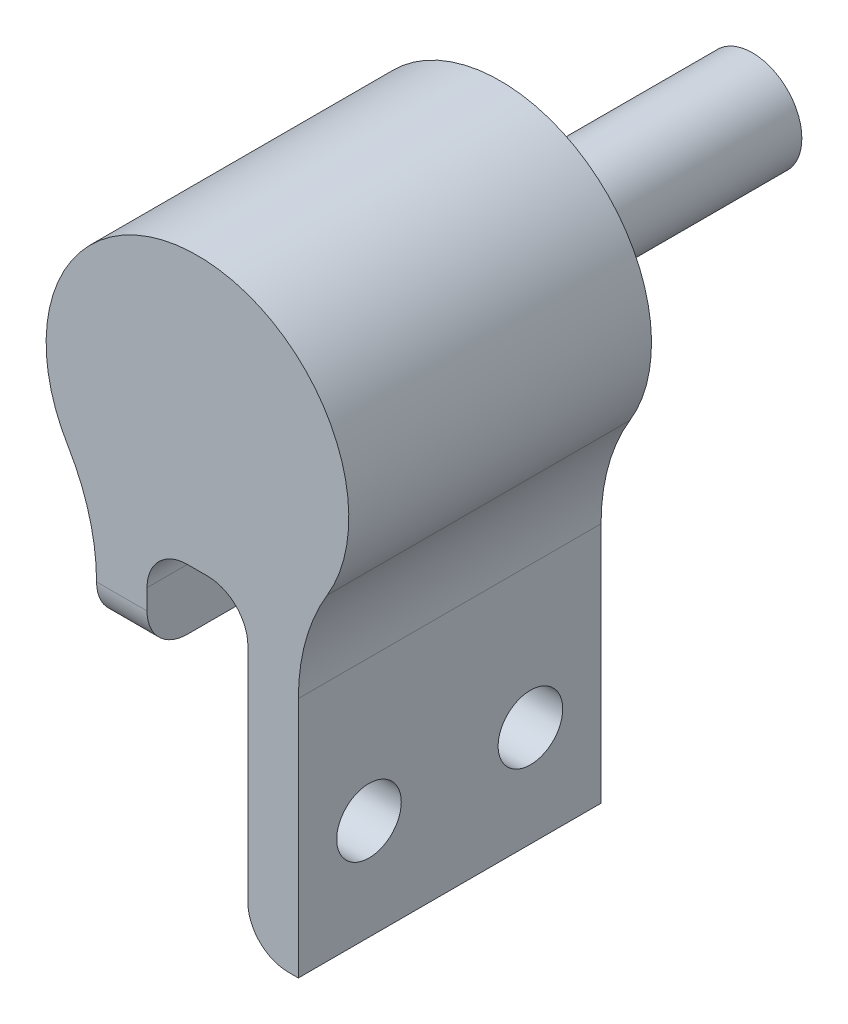
from build123d import *

# Parameters (mm, degrees)
BOSS_EXTRUDE1_DEPTH = 15
SKETCH3_R           = 2.45
BOSS_EXTRUDE2_DEPTH = 12.5
FILLET2_R           = 10
SKETCH8_R           = 1.6
CUT_EXTRUDE6_DEPTH  = 29.681007074
CUT_EXTRUDE7_REACH  = 30.681
SKETCH9_W           = 7.5
SKETCH9_H           = 10
CUT_EXTRUDE8_REACH  = 30.681
SKETCH10_R          = 1.6
FILLET3_R           = 1
FILLET4_R           = 2


with BuildPart() as part:
    # Sketch2 → Boss-Extrude1 (new body)
    with BuildSketch(Plane.XY):
        with BuildLine():
            Line((-2.5, -6.008335649), (-2.5, -21.008335649))
            Line((-2.5, -21.008335649), (-5, -21.008335649))
            Line((-5, -21.008335649), (-5, -6.008335649))
            Line((-5, -6.008335649), (-5, -5.590169944))
            ThreePointArc((-5, -5.590169944), (0, 7.5), (5, -5.590169944))
            Line((5, -5.590169944), (5, -6.008335649))
            Line((5, -6.008335649), (5, -21.008335649))
            Line((5, -21.008335649), (2.5, -21.008335649))
            Line((2.5, -21.008335649), (2.5, -6.008335649))
            Line((2.5, -6.008335649), (-2.5, -6.008335649))
        make_face()
    extrude(amount=BOSS_EXTRUDE1_DEPTH)

    # Sketch3 → Boss-Extrude2 (add)
    with BuildSketch(Plane(origin=(0, 0, 0), x_dir=(-1, 0, 0), z_dir=(0, 0, -1))):
        Circle(SKETCH3_R)
    extrude(amount=BOSS_EXTRUDE2_DEPTH)

    # Fillet2
    fillet2_edges = [part.edges().sort_by_distance(p)[0] for p in [
        (-5, -5.590169944, 7.5),
        (5, -5.590169944, 7.5),
    ]]
    fillet(fillet2_edges, radius=FILLET2_R)

    # Sketch8 → Cut-Extrude6 (cut, through all)
    with BuildSketch(Plane(origin=(5, 0, 0), x_dir=(0, 0, -1), z_dir=(1, 0, 0))):
        with Locations((-3.5, -16.008335649)):
            Circle(SKETCH8_R)
    extrude(amount=-CUT_EXTRUDE6_DEPTH, mode=Mode.SUBTRACT)

    # Sketch9 → Cut-Extrude7 (cut, up to next)
    with BuildSketch(Plane.ZY.offset(5), mode=Mode.PRIVATE) as cut_extrude7_sk1:
        with Locations((11.25, -16.008335649)):
            Rectangle(SKETCH9_W, SKETCH9_H)
    cut_extrude7_tool1 = extrude(cut_extrude7_sk1.sketch, amount=-CUT_EXTRUDE7_REACH, mode=Mode.PRIVATE) & part.part
    add(cut_extrude7_tool1.solids().sort_by_distance((-5, -16.008336, 11.25))[0], mode=Mode.SUBTRACT)

    # Sketch10 → Cut-Extrude8 (cut, up to next)
    with BuildSketch(Plane(origin=(5, 0, 0), x_dir=(0, 0, -1), z_dir=(1, 0, 0)), mode=Mode.PRIVATE) as cut_extrude8_sk1:
        with Locations((-11.5, -16.008335649)):
            Circle(SKETCH10_R)
    cut_extrude8_tool1 = extrude(cut_extrude8_sk1.sketch, amount=-CUT_EXTRUDE8_REACH, mode=Mode.PRIVATE) & part.part
    add(cut_extrude8_tool1.solids().sort_by_distance((5, -16.008336, 11.5))[0], mode=Mode.SUBTRACT)

    # Fillet3
    fillet3_edges = [part.edges().sort_by_distance(p)[0] for p in [
        (2.45, 0, 0),
    ]]
    fillet(fillet3_edges, radius=FILLET3_R)

    # Fillet4
    fillet4_edges = [part.edges().sort_by_distance(p)[0] for p in [
        (2.5, -6.008335649, 7.5),
        (-2.5, -6.008335649, 7.5),
        (-3.75, -11.008335649, 7.5),
        (-3.75, -11.008335649, 15),
        (-2.5, -21.008335649, 3.75),
        (2.5, -21.008335649, 7.5),
    ]]
    fillet(fillet4_edges, radius=FILLET4_R)


solid = part.part
